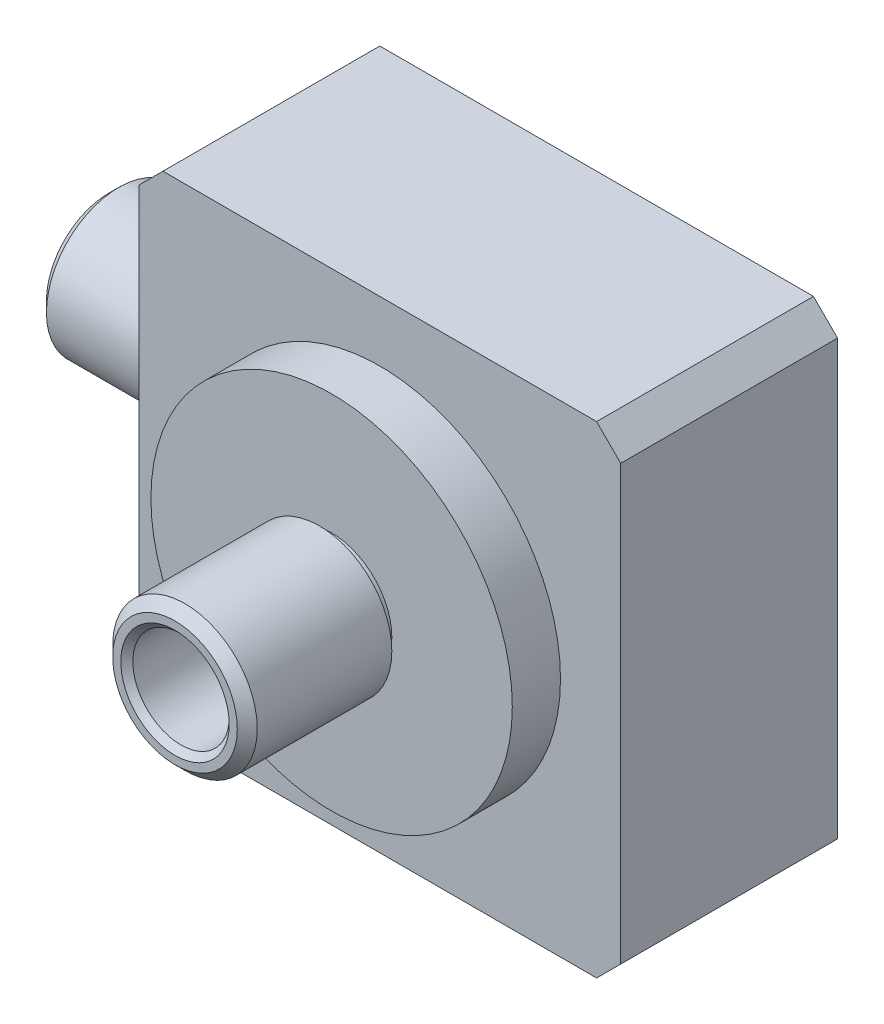
from build123d import *

# Parameters (mm, degrees)
SKETCH_1_W          = 40
SKETCH_1_H          = 40
EXTRUDE_1_DEPTH     = 18
SKETCH_2_R          = 15
EXTRUDE_2_DEPTH     = 4
SKETCH_3_R          = 5
EXTRUDE_3_DEPTH     = 1
SKETCH_4_R          = 6
EXTRUDE_4_DEPTH     = 12
SKETCH_5_R          = 5
EXTRUDE_5_DEPTH     = 1
SKETCH_6_R          = 6
EXTRUDE_6_DEPTH     = 12.5
SKETCH_8_R          = 2.5
CUT_EXTRUDE_1_DEPTH = 53.414215629
SKETCH_9_R          = 4
CUT_EXTRUDE_2_DEPTH = 10
CUT_EXTRUDE_3_REACH = 68.987
SKETCH_10_R         = 2.5
SKETCH_11_R         = 4
CUT_EXTRUDE_4_DEPTH = 10
CHAMFER_1_SIZE      = 0.5
CHAMFER_2_SIZE      = 0.828
CHAMFER_3_SIZE      = 2


with BuildPart() as part:
    # Эскиз1 → Бобышка-Вытянуть1 (new body)
    with BuildSketch(Plane.XY):
        Rectangle(SKETCH_1_W, SKETCH_1_H)
    extrude(amount=EXTRUDE_1_DEPTH)

    # Эскиз2 → Бобышка-Вытянуть2 (add)
    with BuildSketch(Plane.XY.offset(18)):
        Circle(SKETCH_2_R)
    extrude(amount=EXTRUDE_2_DEPTH)

    # Эскиз3 → Бобышка-Вытянуть3 (add)
    with BuildSketch(Plane.XY.offset(22)):
        Circle(SKETCH_3_R)
    extrude(amount=EXTRUDE_3_DEPTH)

    # Эскиз4 → Бобышка-Вытянуть4 (add)
    with BuildSketch(Plane.XY.offset(23)):
        Circle(SKETCH_4_R)
    extrude(amount=EXTRUDE_4_DEPTH)

    # Эскиз5 → Бобышка-Вытянуть5 (add)
    with BuildSketch(Plane.ZY.offset(20)):
        with Locations((7, 0)):
            Circle(SKETCH_5_R)
    extrude(amount=EXTRUDE_5_DEPTH)

    # Эскиз6 → Бобышка-Вытянуть6 (add)
    with BuildSketch(Plane.ZY.offset(21)):
        with Locations((7, 0)):
            Circle(SKETCH_6_R)
    extrude(amount=EXTRUDE_6_DEPTH)

    # Эскиз7 → Вырез-Повернуть1 (revolve, cut)
    with BuildSketch(Plane(origin=(0, 0, 0), x_dir=(1, 0, 0), z_dir=(0, 1, 0))):
        Polygon((0, 0), (0, -8), (3.5, -8), (8.696152423, -11), (11, -11), (11, 0), align=None)
    revolve(axis=Axis((0, 0, 0), (0, 0, 1)), mode=Mode.SUBTRACT)

    # Эскиз8 → Вырез-Вытянуть1 (cut, through all)
    with BuildSketch(Plane.XY.offset(35)):
        Circle(SKETCH_8_R)
    extrude(amount=-CUT_EXTRUDE_1_DEPTH, mode=Mode.SUBTRACT)

    # Эскиз9 → Вырез-Вытянуть2 (cut)
    with BuildSketch(Plane.XY.offset(35)):
        Circle(SKETCH_9_R)
    extrude(amount=-CUT_EXTRUDE_2_DEPTH, mode=Mode.SUBTRACT)

    # Эскиз10 → Вырез-Вытянуть3 (cut, up to next)
    with BuildSketch(Plane.ZY.offset(33.5), mode=Mode.PRIVATE) as cut_extrude_3_sk1:
        with Locations((7, 0)):
            Circle(SKETCH_10_R)
    cut_extrude_3_tool1 = extrude(cut_extrude_3_sk1.sketch, amount=-CUT_EXTRUDE_3_REACH, mode=Mode.PRIVATE) & part.part
    add(cut_extrude_3_tool1.solids().sort_by_distance((-33.5, 0, 7))[0], mode=Mode.SUBTRACT)

    # Эскиз11 → Вырез-Вытянуть4 (cut)
    with BuildSketch(Plane.ZY.offset(33.5)):
        with Locations((7, 0)):
            Circle(SKETCH_11_R)
    extrude(amount=-CUT_EXTRUDE_4_DEPTH, mode=Mode.SUBTRACT)

    # Фаска1
    chamfer_1_edges = [part.edges().sort_by_distance(p)[0] for p in [
        (-4, 0, 35),
        (-33.5, 0, 3),
    ]]
    chamfer(chamfer_1_edges, length=CHAMFER_1_SIZE)

    # Фаска2
    chamfer_2_edges = [part.edges().sort_by_distance(p)[0] for p in [
        (-6, 0, 35),
        (-33.5, 0, 1),
    ]]
    chamfer(chamfer_2_edges, length=CHAMFER_2_SIZE)

    # Фаска3
    chamfer_3_edges = [part.edges().sort_by_distance(p)[0] for p in [
        (-20, 20, 9),
        (20, 20, 9),
        (20, -20, 9),
        (-20, -20, 9),
    ]]
    chamfer(chamfer_3_edges, length=CHAMFER_3_SIZE)

    # Эскиз12 → Вырез-Повернуть2 (revolve, cut)
    with BuildSketch(Plane(origin=(0, 0, 0), x_dir=(1, 0, 0), z_dir=(0, 1, 0))):
        with BuildLine():
            Line((13.5, 0), (13.5, 3))
            ThreePointArc((13.5, 3), (15.5, 5), (17.5, 3))
            Line((17.5, 3), (17.5, 0))
            ThreePointArc((17.5, 0), (15.5, -2), (13.5, 0))
        make_face()
    revolve(axis=Axis((0, 0, 0), (0, 0, 1)), mode=Mode.SUBTRACT)


solid = part.part
